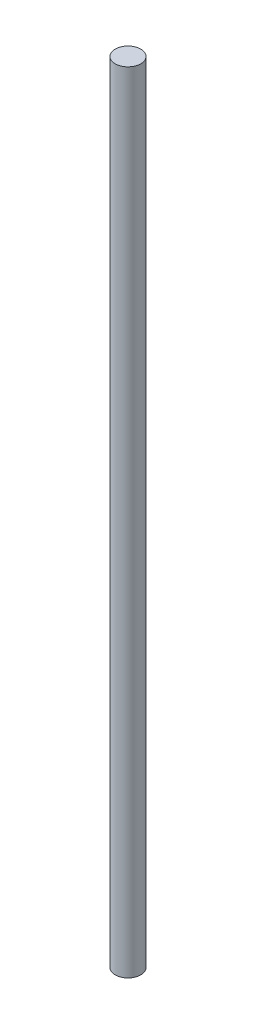
from build123d import *

# Parameters (mm, degrees)
SKETCH1_R           = 1
BOSS_EXTRUDE1_DEPTH = 61.8


with BuildPart() as part:
    # Sketch1 → Boss-Extrude1 (new body)
    with BuildSketch(Plane(origin=(0, 0, 0), x_dir=(1, 0, 0), z_dir=(0, 1, 0))):
        with Locations(Location((0, 0, 0), (0, 0, 270))):
            Circle(SKETCH1_R)
    extrude(amount=BOSS_EXTRUDE1_DEPTH)


solid = part.part
